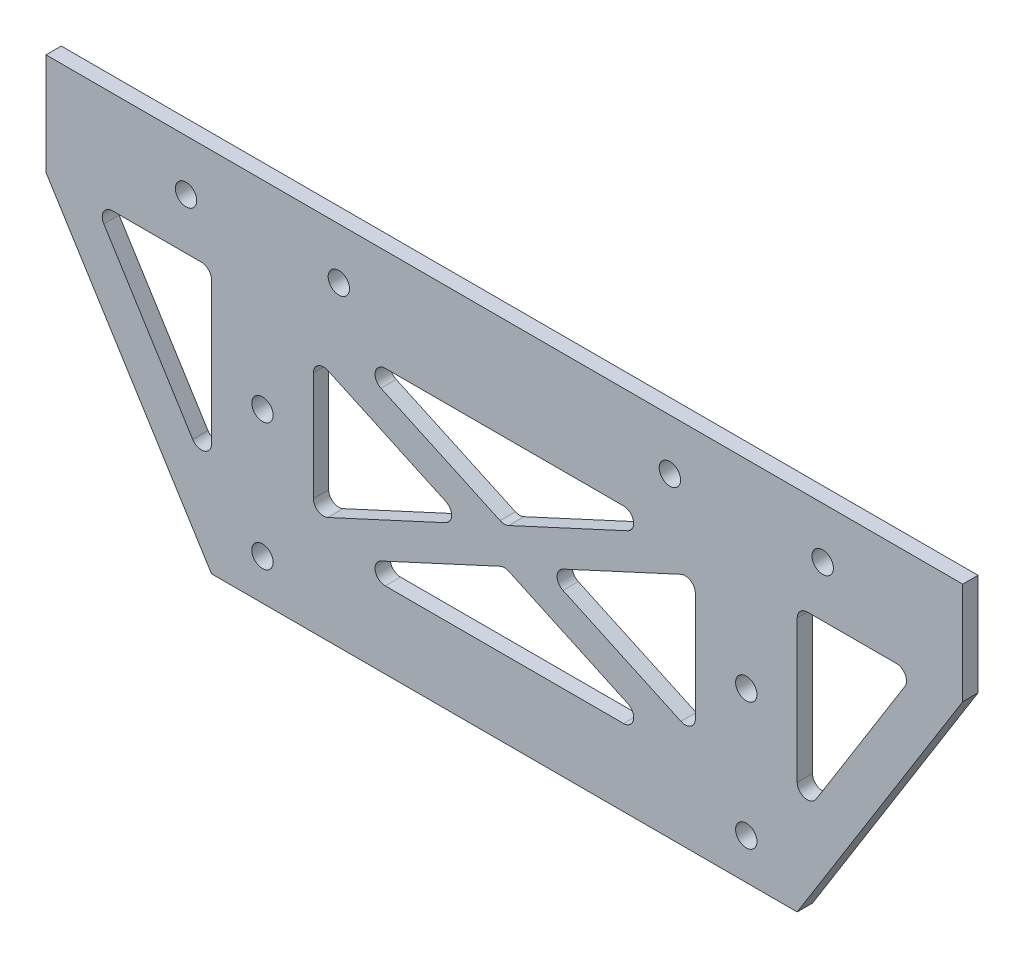
from build123d import *

# Parameters (mm, degrees)
SKETCH_1_W              = 180
SKETCH_1_H              = 72
EXTRUDE_1_DEPTH         = 3
HOLE_WIZARD_4_2_4_2_1_D = 4.2
CUT_EXTRUDE_2_DEPTH     = 97.979379251
CUT_EXTRUDE_3_DEPTH     = 97.979379251


with BuildPart() as part:
    # 草图1 → 凸台-拉伸1 (new body)
    with BuildSketch(Plane.XY):
        Rectangle(SKETCH_1_W, SKETCH_1_H)
    extrude(amount=EXTRUDE_1_DEPTH)

    # Ø4.2 (4.2) 直径孔1 (through all)
    with Locations(Plane(origin=(-62.5, 26, 3), x_dir=(1, 0, 0), z_dir=(0, 0, 1))):
        with Locations((0, 0), (30, 0), (15, -29), (15, -54), (110, -54), (110, -29), (125, 0), (95, 0)):
            Hole(HOLE_WIZARD_4_2_4_2_1_D / 2)

    # 草图8 → 切除-拉伸2 (cut, through all)
    with BuildSketch(Plane(origin=(0, 0, 0), x_dir=(-1, 0, 0), z_dir=(0, 0, -1))):
        Polygon((-90, 16), (-57.5, -36), (-90, -36), align=None)
        Polygon((90, -36), (90, 16), (57.5, -36), align=None)
    extrude(amount=-CUT_EXTRUDE_2_DEPTH, mode=Mode.SUBTRACT)

    # 草图6 → 切除-拉伸3 (cut, through all)
    with BuildSketch(Plane(origin=(0, 0, 0), x_dir=(-1, 0, 0), z_dir=(0, 0, -1))):
        with BuildLine():
            Line((57.5, 14), (57.5, -13.932037736))
            ThreePointArc((57.5, -13.932037736), (58.948634974, -15.854535228), (61.195996608, -14.992035616))
            Line((61.195996608, -14.992035616), (78.653520193, 12.94000212))
            ThreePointArc((78.653520193, 12.94000212), (78.706808547, 14.969537065), (76.957523585, 16))
            Line((76.957523585, 16), (59.5, 16))
            ThreePointArc((59.5, 16), (58.085786438, 15.414213562), (57.5, 14))
        make_face()
        with BuildLine():
            Line((-76.957523585, 16), (-59.5, 16))
            ThreePointArc((-59.5, 16), (-58.085786438, 15.414213562), (-57.5, 14))
            Line((-57.5, 14), (-57.5, -13.932037736))
            ThreePointArc((-57.5, -13.932037736), (-58.948634974, -15.854535228), (-61.195996608, -14.992035616))
            Line((-61.195996608, -14.992035616), (-78.653520193, 12.94000212))
            ThreePointArc((-78.653520193, 12.94000212), (-78.706808547, 14.969537065), (-76.957523585, 16))
        make_face()
        with BuildLine():
            Line((-23.394059646, 16), (23.394059646, 16))
            ThreePointArc((23.394059646, 16), (25.347497325, 14.429046887), (24.232176, 12.184081231))
            Line((24.232176, 12.184081231), (0.838116355, 1.386822933))
            ThreePointArc((0.838116355, 1.386822933), (0, 1.202741702), (-0.838116355, 1.386822933))
            Line((-0.838116355, 1.386822933), (-24.232176, 12.184081231))
            ThreePointArc((-24.232176, 12.184081231), (-25.347497325, 14.429046887), (-23.394059646, 16))
        make_face()
        with BuildLine():
            Line((-37.5, 8.181873683), (-37.5, -13.181873683))
            ThreePointArc((-37.5, -13.181873683), (-36.577907067, -14.866544676), (-34.661883645, -14.997792452))
            Line((-34.661883645, -14.997792452), (-11.517824, -4.315918769))
            ThreePointArc((-11.517824, -4.315918769), (-10.355940354, -2.5), (-11.517824, -0.684081231))
            Line((-11.517824, -0.684081231), (-34.661883645, 9.997792452))
            ThreePointArc((-34.661883645, 9.997792452), (-36.577907067, 9.866544676), (-37.5, 8.181873683))
        make_face()
        with BuildLine():
            Line((-23.394059646, -21), (23.394059646, -21))
            ThreePointArc((23.394059646, -21), (25.347497325, -19.429046887), (24.232176, -17.184081231))
            Line((24.232176, -17.184081231), (0.838116355, -6.386822933))
            ThreePointArc((0.838116355, -6.386822933), (0, -6.202741702), (-0.838116355, -6.386822933))
            Line((-0.838116355, -6.386822933), (-24.232176, -17.184081231))
            ThreePointArc((-24.232176, -17.184081231), (-25.347497325, -19.429046887), (-23.394059646, -21))
        make_face()
        with BuildLine():
            Line((37.5, 8.181873683), (37.5, -13.181873683))
            ThreePointArc((37.5, -13.181873683), (36.577907067, -14.866544676), (34.661883645, -14.997792452))
            Line((34.661883645, -14.997792452), (11.517824, -4.315918769))
            ThreePointArc((11.517824, -4.315918769), (10.355940354, -2.5), (11.517824, -0.684081231))
            Line((11.517824, -0.684081231), (34.661883645, 9.997792452))
            ThreePointArc((34.661883645, 9.997792452), (36.577907067, 9.866544676), (37.5, 8.181873683))
        make_face()
    extrude(amount=-CUT_EXTRUDE_3_DEPTH, mode=Mode.SUBTRACT)


solid = part.part
